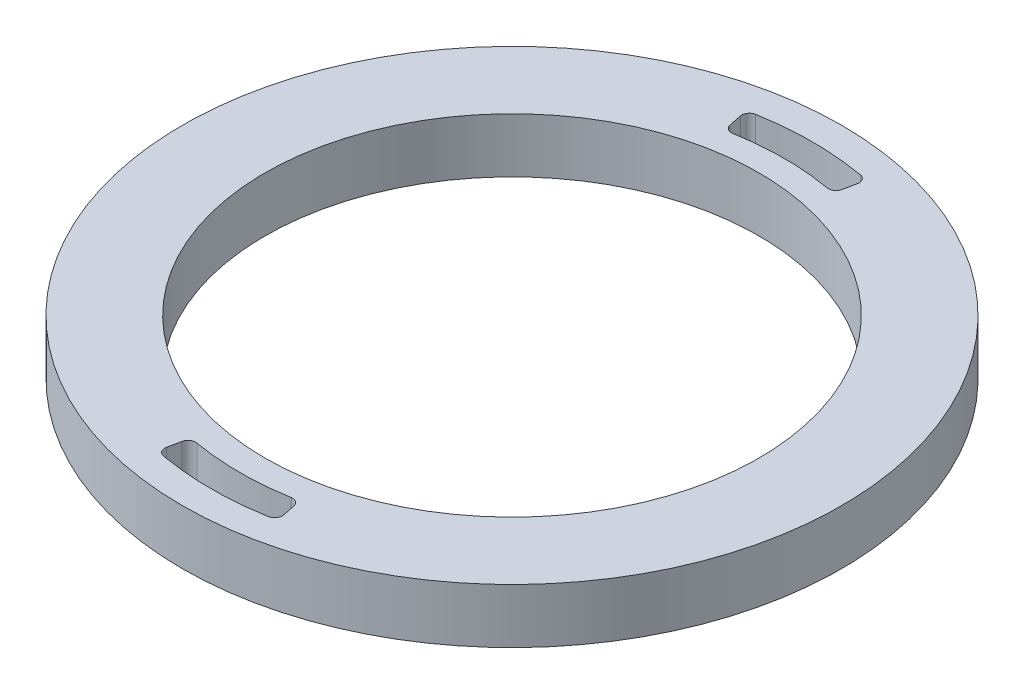
from build123d import *

# Parameters (mm, degrees)
SKETCH1_R           = 38.2905
SKETCH1_R_2         = 28.702
BOSS_EXTRUDE1_DEPTH = 6.35
CUT_EXTRUDE1_DEPTH  = 6.35
FILLET1_R           = 0.889


with BuildPart() as part:
    # Sketch1 → Boss-Extrude1 (new body)
    with BuildSketch(Plane(origin=(0, 0, 0), x_dir=(1, 0, 0), z_dir=(0, 1, 0))):
        with Locations(Location((0, 0, 0), (0, 0, 270))):
            Circle(SKETCH1_R)
        with Locations(Location((0, 0, 0), (0, 0, 270))):
            Circle(SKETCH1_R_2, mode=Mode.SUBTRACT)
    extrude(amount=BOSS_EXTRUDE1_DEPTH)

    # Sketch2 → Cut-Extrude1 (cut)
    with BuildSketch(Plane(origin=(0, 6.35, 0), x_dir=(1, 0, 0), z_dir=(0, 1, 0))):
        with BuildLine():
            ThreePointArc((6.3246, 30.984085654), (0, 31.623), (-6.3246, 30.984085654))
            Line((-6.3246, 30.984085654), (-6.985, 34.219371707))
            ThreePointArc((-6.985, 34.219371707), (0, 34.925), (6.985, 34.219371707))
            Line((6.985, 34.219371707), (6.3246, 30.984085654))
        make_face()
        with BuildLine():
            ThreePointArc((6.3246, -30.984085654), (0, -31.623), (-6.3246, -30.984085654))
            Line((-6.3246, -30.984085654), (-6.985, -34.219371707))
            ThreePointArc((-6.985, -34.219371707), (0, -34.925), (6.985, -34.219371707))
            Line((6.985, -34.219371707), (6.3246, -30.984085654))
        make_face()
    extrude(amount=-CUT_EXTRUDE1_DEPTH, mode=Mode.SUBTRACT)

    # Fillet1
    fillet1_edges = [part.edges().sort_by_distance(p)[0] for p in [
        (6.3246, 3.175, -30.984085654),
        (-6.3246, 3.175, -30.984085654),
        (-6.985, 3.175, -34.219371707),
        (6.985, 3.175, -34.219371707),
        (-6.985, 3.175, 34.219371707),
        (-6.3246, 3.175, 30.984085654),
        (6.3246, 3.175, 30.984085654),
        (6.985, 3.175, 34.219371707),
    ]]
    fillet(fillet1_edges, radius=FILLET1_R)


solid = part.part
